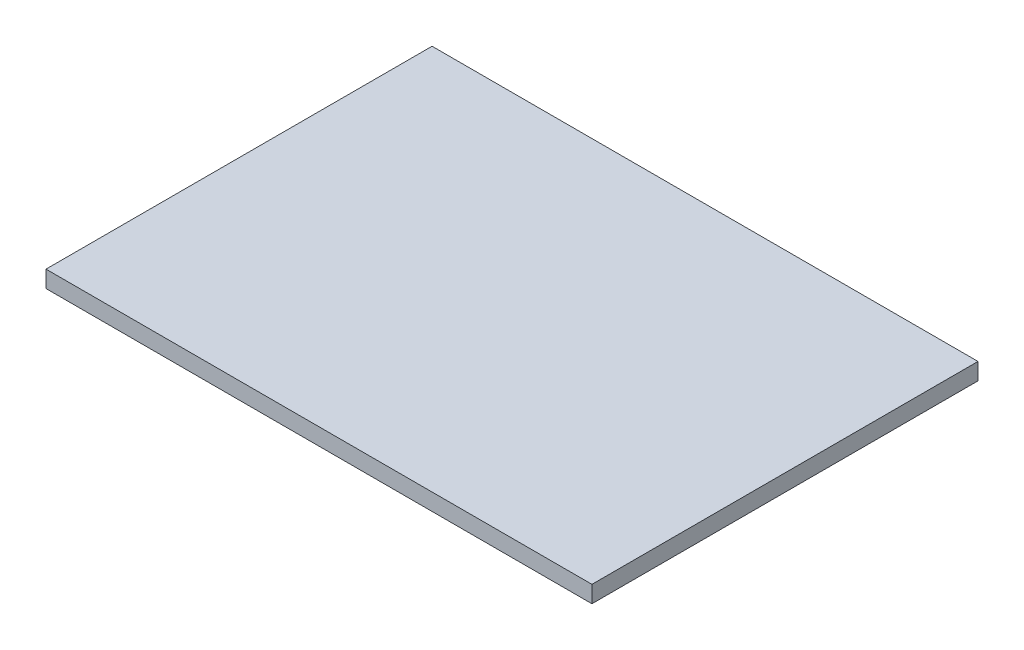
from build123d import *

# Parameters (mm, degrees)
SKETCH1_W               = 210
SKETCH1_H               = 148.5
BOSS_EXTRUDE1_DEPTH     = 10
CUT_EXTRUDE1_DEPTH      = 183.146232462
CUT_EXTRUDE1_DEPTH_BACK = 183.146232462
SKETCH2_W               = 210
SKETCH2_H               = 3.522009996


with BuildPart() as part:
    # Sketch1 → Boss-Extrude1 (new body)
    with BuildSketch(Plane(origin=(0, 0, 0), x_dir=(1, 0, 0), z_dir=(0, 1, 0))):
        Rectangle(SKETCH1_W, SKETCH1_H)
    extrude(amount=BOSS_EXTRUDE1_DEPTH)

    # Sketch2 → Cut-Extrude1 (cut, two sides: drawn at the far end of the back side and taken through both)
    with BuildSketch(Plane.XY.offset(74.25).offset(-CUT_EXTRUDE1_DEPTH_BACK)):
        with Locations((0, 8.238995002)):
            Rectangle(SKETCH2_W, SKETCH2_H)
    extrude(amount=CUT_EXTRUDE1_DEPTH + CUT_EXTRUDE1_DEPTH_BACK, mode=Mode.SUBTRACT)


solid = part.part
